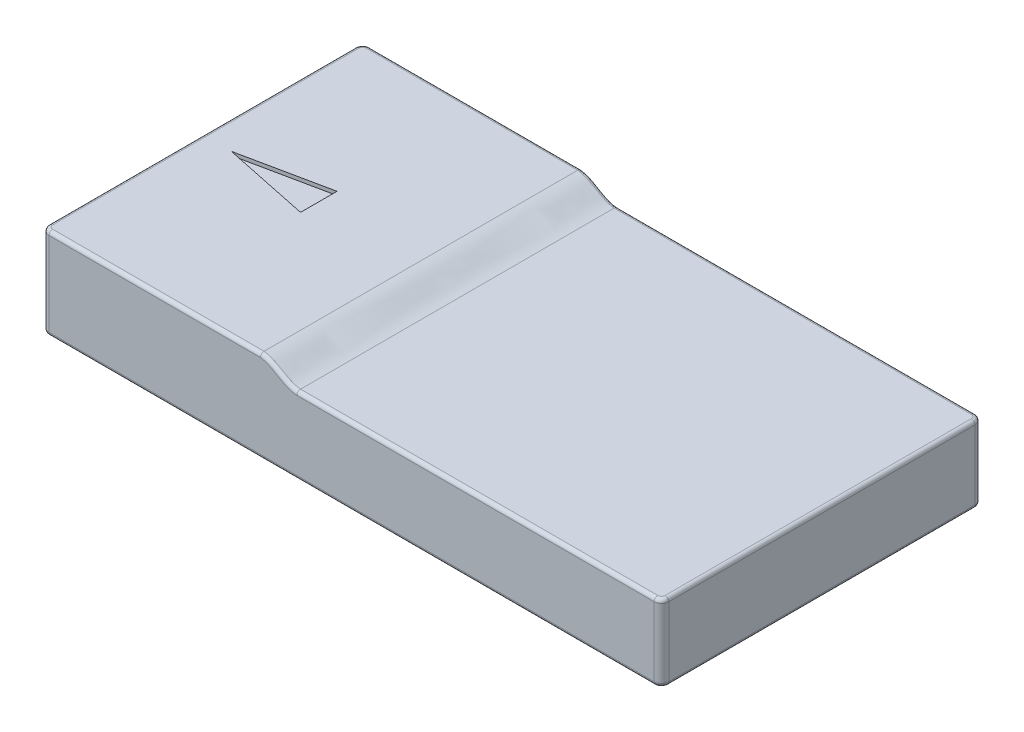
from build123d import *

# Parameters (mm, degrees)
SKETCH1_W               = 85
SKETCH1_H               = 44
BOSS_EXTRUDE1_DEPTH     = 15
CUT_EXTRUDE1_DEPTH      = 51.152268144
CUT_EXTRUDE1_DEPTH_BACK = 51.152268144
FILLET1_R               = 1
FILLET2_R               = 0.5
FILLET3_R               = 0.5
CUT_EXTRUDE3_DEPTH      = 0.5


with BuildPart() as part:
    # Sketch1 → Boss-Extrude1 (new body)
    with BuildSketch(Plane(origin=(0, 0, 0), x_dir=(1, 0, 0), z_dir=(0, 1, 0))):
        Rectangle(SKETCH1_W, SKETCH1_H)
    extrude(amount=BOSS_EXTRUDE1_DEPTH)

    # Sketch2 → Cut-Extrude1 (cut, two sides: drawn at the far end of the back side and taken through both)
    with BuildSketch(Plane.XY.offset(-CUT_EXTRUDE1_DEPTH_BACK)):
        with BuildLine():
            Line((-42.5, 12.5), (-12.5, 12.5))
            add(Edge.make_bspline(
                [(-12.5, 12.5), (-10.623415355, 12.323006837), (-9.376584645, 10.676993163), (-7.5, 10.5)],
                knots=[0, 0, 0, 0, 1, 1, 1, 1], degree=3))
            Line((-7.5, 10.5), (42.5, 10.5))
            Line((42.5, 10.5), (42.5, 22.5))
            Line((42.5, 22.5), (-42.5, 22.5))
            Line((-42.5, 22.5), (-42.5, 12.5))
        make_face()
    extrude(amount=CUT_EXTRUDE1_DEPTH + CUT_EXTRUDE1_DEPTH_BACK, mode=Mode.SUBTRACT)

    # Fillet1
    fillet1_edges = [part.edges().sort_by_distance(p)[0] for p in [
        (42.5, 5.25, -22),
        (42.5, 5.25, 22),
        (-42.5, 6.25, 22),
        (-42.5, 6.25, -22),
    ]]
    fillet(fillet1_edges, radius=FILLET1_R)

    # Fillet2
    fillet2_edges = [part.edges().sort_by_distance(p)[0] for p in [
        (17, 10.5, -22),
        (-9.999999993, 11.50000001, -22),
        (-9.999999993, 11.50000001, 22),
        (17, 10.5, 22),
        (-42.5, 12.5, 0),
        (-27, 12.5, -22),
        (-27, 12.5, 22),
        (-42.207106781, 12.5, 21.707106781),
        (-42.207106781, 12.5, -21.707106781),
        (42.5, 10.5, 0),
        (42.207106781, 10.5, 21.707106781),
        (42.207106781, 10.5, -21.707106781),
    ]]
    fillet(fillet2_edges, radius=FILLET2_R)

    # Fillet3
    fillet3_edges = [part.edges().sort_by_distance(p)[0] for p in [
        (-42.5, 0, 0),
        (0, 0, -22),
        (42.5, 0, 0),
        (0, 0, 22),
        (-42.207106781, 0, 21.707106781),
        (42.207106781, 0, 21.707106781),
        (42.207106781, 0, -21.707106781),
        (-42.207106781, 0, -21.707106781),
    ]]
    fillet(fillet3_edges, radius=FILLET3_R)

    # Sketch4 → Cut-Extrude3 (cut)
    with BuildSketch(Plane(origin=(0, 12.5, 0), x_dir=(1, 0, 0), z_dir=(0, 1, 0))):
        Polygon((-38.5, 0), (-26.5, 2.5), (-26.5, -2.5), align=None)
    extrude(amount=-CUT_EXTRUDE3_DEPTH, mode=Mode.SUBTRACT)


solid = part.part
